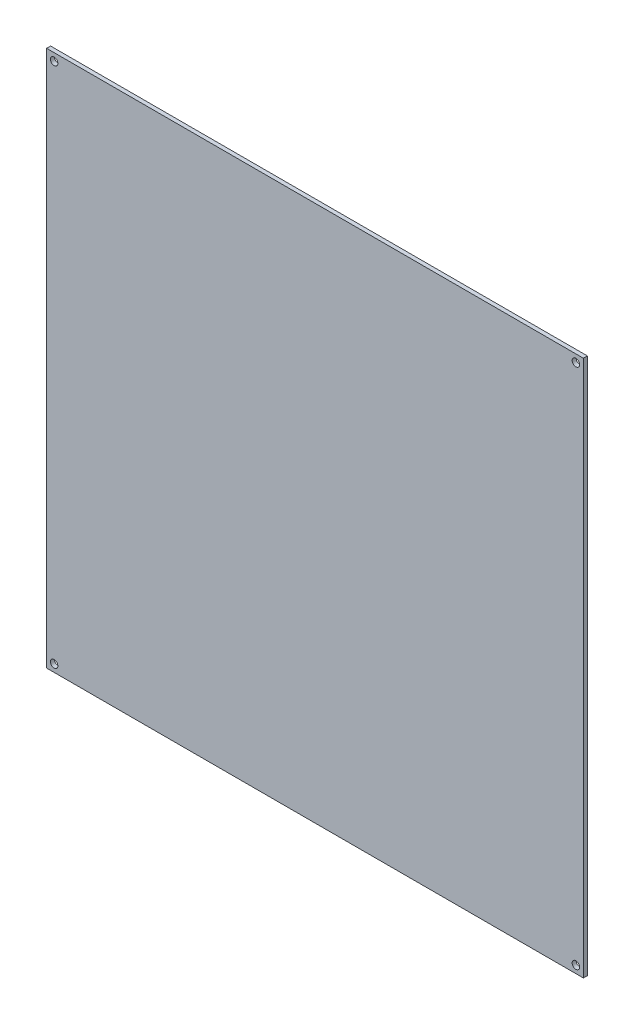
from build123d import *

# Parameters (mm, degrees)
SKETCH1_W           = 215
SKETCH1_H           = 215
BOSS_EXTRUDE1_DEPTH = 1.6
SKETCH2_R           = 1.5
CUT_EXTRUDE1_DEPTH  = 153.036377226


with BuildPart() as part:
    # Sketch1 → Boss-Extrude1 (new body)
    with BuildSketch(Plane.XY):
        Rectangle(SKETCH1_W, SKETCH1_H)
    extrude(amount=BOSS_EXTRUDE1_DEPTH)

    # Sketch2 → Cut-Extrude1 (cut, through all)
    with BuildSketch(Plane.XY.offset(1.6)):
        with Locations((-104.5, 104.5)):
            Circle(SKETCH2_R)
        with Locations((104.5, 104.5)):
            Circle(SKETCH2_R)
        with Locations((104.5, -104.5)):
            Circle(SKETCH2_R)
        with Locations((-104.5, -104.5)):
            Circle(SKETCH2_R)
    extrude(amount=-CUT_EXTRUDE1_DEPTH, mode=Mode.SUBTRACT)


solid = part.part
